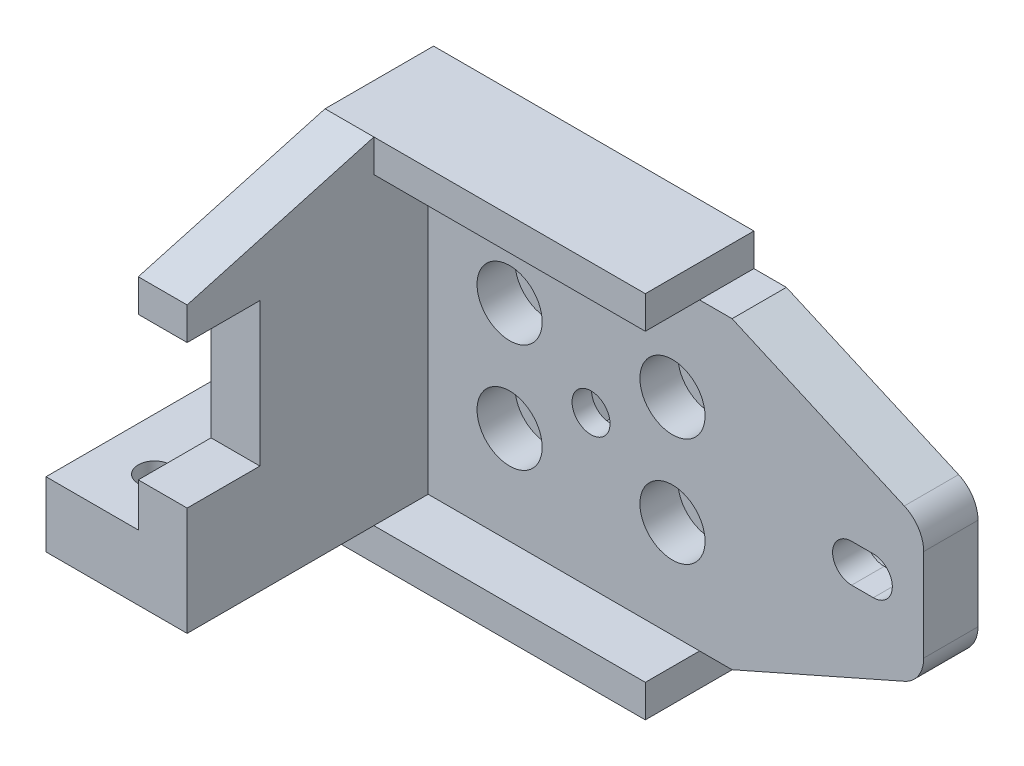
from build123d import *

# Parameters (mm, degrees)
SKETCH_1_W          = 20
SKETCH_1_H          = 34
EXTRUDE_1_DEPTH     = 5
SKETCH_2_W          = 20
SKETCH_2_H          = 3
EXTRUDE_2_DEPTH     = 5
EXTRUDE_3_DEPTH     = 5
FILLET_1_R          = 3
CUT_EXTRUDE_1_DEPTH = 2
SKETCH_7_R          = 1.6
CUT_EXTRUDE_2_DEPTH = 41.087864079
SKETCH_8_R          = 1.75
CUT_EXTRUDE_3_DEPTH = 41.087864079
CUT_EXTRUDE_5_DEPTH = 3.2
EXTRUDE_17_DEPTH    = 18
SKETCH_14_W         = 13
SKETCH_14_H         = 31
EXTRUDE_18_DEPTH    = 30
SKETCH_15_R         = 1.5
SKETCH_15_W         = 20.470707414
SKETCH_15_H         = 10.803453681
CUT_EXTRUDE_6_DEPTH = 61.249481326
SKETCH_16_W         = 16.444381011
SKETCH_16_H         = 28.281193961
CUT_EXTRUDE_7_DEPTH = 25
SKETCH_17_W         = 5
SKETCH_17_H         = 3
EXTRUDE_19_DEPTH    = 5
SKETCH_18_R         = 3
CUT_EXTRUDE_8_DEPTH = 3.5
SKETCH_19_W         = 4.5
SKETCH_19_H         = 27.2
EXTRUDE_20_DEPTH    = 25
SKETCH_20_W         = 8
SKETCH_20_H         = 13.2
CUT_EXTRUDE_9_DEPTH = 64.078600555


with BuildPart() as part:
    # 草图1 → 凸台-拉伸1 (new body)
    with BuildSketch(Plane.XY):
        with Locations((-10, 17)):
            Rectangle(SKETCH_1_W, SKETCH_1_H)
    extrude(amount=EXTRUDE_1_DEPTH)

    # 草图2 → 凸台-拉伸2 (add)
    with BuildSketch(Plane.XY.offset(5)):
        with Locations((-10, 32.5)):
            Rectangle(SKETCH_2_W, SKETCH_2_H)
        with Locations((-10, 1.5)):
            Rectangle(SKETCH_2_W, SKETCH_2_H)
    extrude(amount=EXTRUDE_2_DEPTH)

    # 草图4 → 凸台-拉伸3 (add)
    with BuildSketch(Plane(origin=(0, 0, 0), x_dir=(-1, 0, 0), z_dir=(0, 0, -1))):
        Polygon((0, 3), (0, 31), (-2.991740991, 31), (-20.640660029, 23.203556304), (-20.640660029, 10.796443696), (-2.991740991, 3), align=None)
        with BuildLine():
            ThreePointArc((-16, 15.25), (-17.75, 17), (-16, 18.75))
            Line((-16, 18.75), (-14, 18.75))
            ThreePointArc((-14, 18.75), (-12.25, 17), (-14, 15.25))
            Line((-14, 15.25), (-16, 15.25))
        make_face(mode=Mode.SUBTRACT)
    extrude(amount=-EXTRUDE_3_DEPTH)

    # 圆角1
    fillet_1_edges = [part.edges().sort_by_distance(p)[0] for p in [
        (20.640660029, 10.796443696, 2.5),
        (20.640660029, 23.203556304, 2.5),
    ]]
    fillet(fillet_1_edges, radius=FILLET_1_R)

    # 草图5 → 切除-拉伸1 (cut)
    with BuildSketch(Plane(origin=(0, 0, 0), x_dir=(-1, 0, 0), z_dir=(0, 0, -1))):
        with BuildLine():
            Line((-16, 20.25), (-13.505814151, 20.212208017))
            ThreePointArc((-13.505814151, 20.212208017), (-10.759461769, 16.75218561), (-14, 13.75))
            Line((-14, 13.75), (-16, 13.75))
            ThreePointArc((-16, 13.75), (-19.25, 17), (-16, 20.25))
        make_face()
    extrude(amount=-CUT_EXTRUDE_1_DEPTH, mode=Mode.SUBTRACT)

    # 草图7 → 切除-拉伸2 (cut, through all)
    with BuildSketch(Plane.XY.offset(5)):
        with Locations((-17.5, 22)):
            Circle(SKETCH_7_R)
        with Locations((-2.5, 22)):
            Circle(SKETCH_7_R)
        with Locations((-2.5, 12)):
            Circle(SKETCH_7_R)
        with Locations((-17.5, 12)):
            Circle(SKETCH_7_R)
    extrude(amount=-CUT_EXTRUDE_2_DEPTH, mode=Mode.SUBTRACT)

    # 草图8 → 切除-拉伸3 (cut, through all)
    with BuildSketch(Plane.XY.offset(5)):
        with Locations((-10, 17)):
            Circle(SKETCH_8_R)
    extrude(amount=-CUT_EXTRUDE_3_DEPTH, mode=Mode.SUBTRACT)

    # 草图9 → 切除-拉伸5 (cut)
    with BuildSketch(Plane(origin=(0, 0, 0), x_dir=(-1, 0, 0), z_dir=(0, 0, -1))):
        Polygon((11.668772273, 13.964345359), (13.463340173, 16.927371861), (11.7945679, 19.963026502), (8.331227727, 20.035654641), (6.536659827, 17.072628139), (8.2054321, 14.036973498), align=None)
    extrude(amount=-CUT_EXTRUDE_5_DEPTH, mode=Mode.SUBTRACT)

    # 草图12 → 凸台-拉伸17 (add)
    with BuildSketch(Plane.ZY.offset(20)):
        Polygon((10, 3), (5, 3), (5, 34), (0, 34), (0, 3), (0, 0), (10, 0), align=None)
    extrude(amount=EXTRUDE_17_DEPTH)

    # 草图14 → 凸台-拉伸18 (add)
    with BuildSketch(Plane.XY.offset(5)):
        with Locations((-31.5, 18.5)):
            Rectangle(SKETCH_14_W, SKETCH_14_H)
    extrude(amount=EXTRUDE_18_DEPTH)

    # 草图15 → 切除-拉伸6 (cut, through all)
    with BuildSketch(Plane.XZ.offset(-3)):
        with Locations((-33.2, 22)):
            Circle(SKETCH_15_R)
        with Locations((-32.765829074, 32.601726841)):
            Rectangle(SKETCH_15_W, SKETCH_15_H)
    extrude(amount=-CUT_EXTRUDE_6_DEPTH, mode=Mode.SUBTRACT)

    # 草图16 → 切除-拉伸7 (cut)
    with BuildSketch(Plane(origin=(0, 34, 0), x_dir=(1, 0, 0), z_dir=(0, 1, 0))):
        with Locations((-33.222190506, -13.05940302)):
            Rectangle(SKETCH_16_W, SKETCH_16_H)
    extrude(amount=-CUT_EXTRUDE_7_DEPTH, mode=Mode.SUBTRACT)

    # 草图17 → 凸台-拉伸19 (add)
    with BuildSketch(Plane.ZY.offset(20)):
        with Locations((7.5, 32.5)):
            Rectangle(SKETCH_17_W, SKETCH_17_H)
    extrude(amount=EXTRUDE_19_DEPTH)

    # 草图18 → 切除-拉伸8 (cut)
    with BuildSketch(Plane.XY.offset(5)):
        with Locations((-17.5, 22)):
            Circle(SKETCH_18_R)
        with Locations((-2.5, 22)):
            Circle(SKETCH_18_R)
        with Locations((-2.5, 12)):
            Circle(SKETCH_18_R)
        with Locations((-17.5, 12)):
            Circle(SKETCH_18_R)
    extrude(amount=-CUT_EXTRUDE_8_DEPTH, mode=Mode.SUBTRACT)

    # 草图19 → 凸台-拉伸20 (add)
    with BuildSketch(Plane(origin=(0, 9, 0), x_dir=(1, 0, 0), z_dir=(0, 1, 0))):
        with Locations((-27.25, -13.6)):
            Rectangle(SKETCH_19_W, SKETCH_19_H)
    extrude(amount=EXTRUDE_20_DEPTH)

    # 草图20 → 切除-拉伸9 (cut, through all)
    with BuildSketch(Plane(origin=(-25, 0, 0), x_dir=(0, 0, -1), z_dir=(1, 0, 0))):
        with Locations((-24.5, 19.6)):
            Rectangle(SKETCH_20_W, SKETCH_20_H)
        Polygon((-10, 34), (-27.2, 29.2), (-27.2, 34), align=None)
    extrude(amount=-CUT_EXTRUDE_9_DEPTH, mode=Mode.SUBTRACT)


solid = part.part
